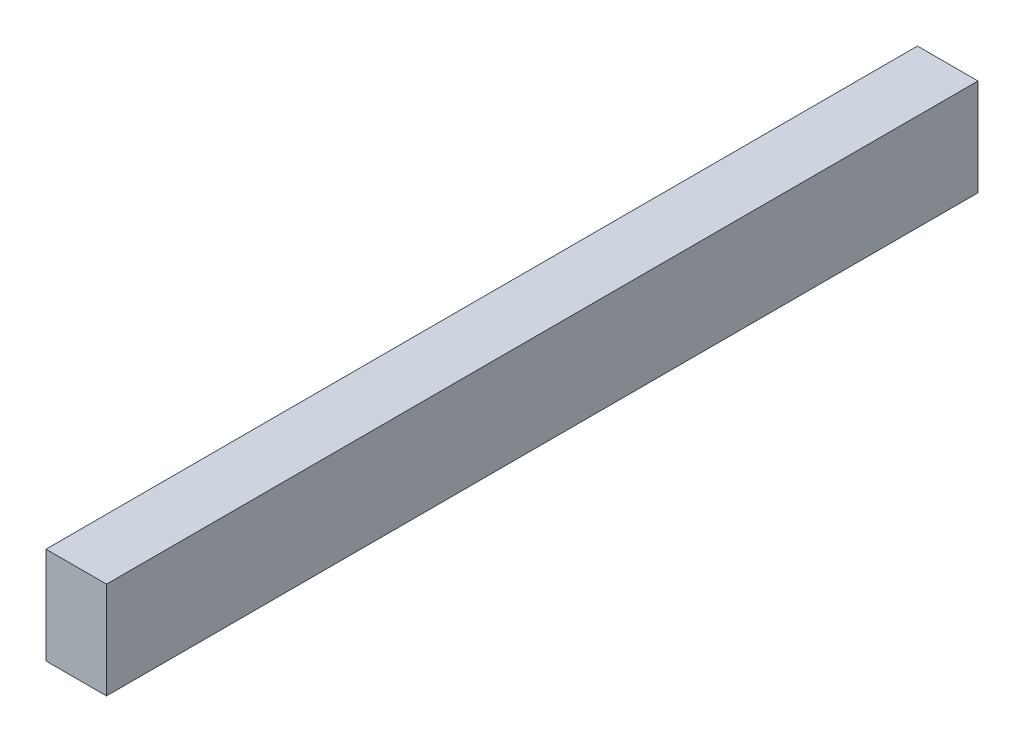
from build123d import *

# Parameters (mm, degrees)
ESQUISSE1_W        = 25
ESQUISSE1_H        = 40
BOSS_EXTRU_1_DEPTH = 360


with BuildPart() as part:
    # Esquisse1 → Boss.-Extru.1 (new body)
    with BuildSketch(Plane.XY):
        with Locations((12.5, 20)):
            Rectangle(ESQUISSE1_W, ESQUISSE1_H)
    extrude(amount=BOSS_EXTRU_1_DEPTH)


solid = part.part
